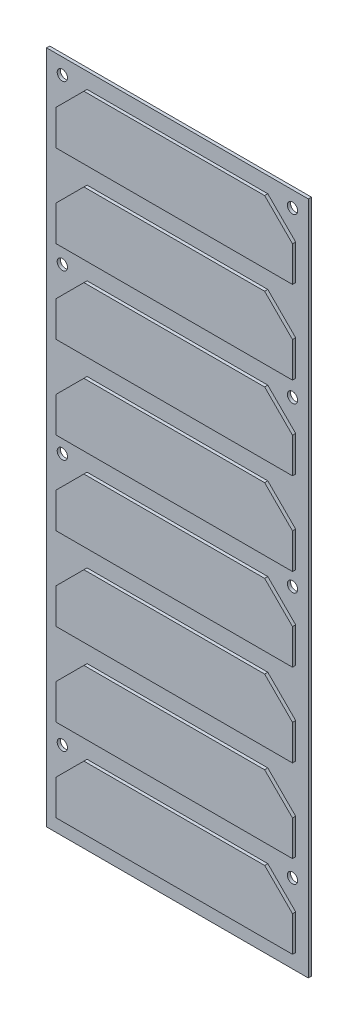
from build123d import *

# Parameters (mm, degrees)
SKETCH1_W                 = 83
SKETCH1_H                 = 214
BOSS_EXTRUDE1_DEPTH       = 1
BOSS_EXTRUDE2_DEPTH       = 1
F_4_CLEARANCE_HOLE1_D     = 3.2639
F_4_CLEARANCE_HOLE1_DEPTH = 3.175
F_4_CLEARANCE_HOLE1_TIP   = 0.980574487


with BuildPart() as part:
    # Sketch1 → Boss-Extrude1 (new body)
    with BuildSketch(Plane.XY):
        Rectangle(SKETCH1_W, SKETCH1_H)
    extrude(amount=BOSS_EXTRUDE1_DEPTH)

    # Sketch2 → Boss-Extrude2 (add)
    with BuildSketch(Plane.XY.offset(1)):
        Polygon((-28.661165235, 102), (28.661165235, 102), (37.5, 93.161165235), (37.5, 82), (-37.5, 82), (-37.5, 93.161165235), align=None)
        Polygon((-28.661165235, 75.714285714), (28.661165235, 75.714285714), (37.5, 66.875450949), (37.5, 55.714285714), (-37.5, 55.714285714), (-37.5, 66.875450949), align=None)
        Polygon((-28.661165235, 49.428571429), (28.661165235, 49.428571429), (37.5, 40.589736664), (37.5, 29.428571429), (-37.5, 29.428571429), (-37.5, 40.589736664), align=None)
        Polygon((-28.661165235, 23.142857143), (28.661165235, 23.142857143), (37.5, 14.304022378), (37.5, 3.142857143), (-37.5, 3.142857143), (-37.5, 14.304022378), align=None)
        Polygon((-28.661165235, -3.142857143), (28.661165235, -3.142857143), (37.5, -11.981691908), (37.5, -23.142857143), (-37.5, -23.142857143), (-37.5, -11.981691908), align=None)
        Polygon((-28.661165235, -29.428571429), (28.661165235, -29.428571429), (37.5, -38.267406193), (37.5, -49.428571429), (-37.5, -49.428571429), (-37.5, -38.267406193), align=None)
        Polygon((-28.661165235, -55.714285714), (28.661165235, -55.714285714), (37.5, -64.553120479), (37.5, -75.714285714), (-37.5, -75.714285714), (-37.5, -64.553120479), align=None)
        Polygon((-28.661165235, -82), (28.661165235, -82), (37.5, -90.838834765), (37.5, -102), (-37.5, -102), (-37.5, -90.838834765), align=None)
    extrude(amount=BOSS_EXTRUDE2_DEPTH)

    # #4 Clearance Hole1
    with Locations(Plane.XY.offset(1)):
        with Locations((-36.5, 102), (36.5, 102), (36.5, 50), (36.5, -2), (36.5, -82), (-36.5, -82), (-36.5, -2), (-36.5, 50)):
            Hole(F_4_CLEARANCE_HOLE1_D / 2, depth=F_4_CLEARANCE_HOLE1_DEPTH)
            with Locations((0, 0, -(F_4_CLEARANCE_HOLE1_DEPTH + F_4_CLEARANCE_HOLE1_TIP / 2))):  # 118° drill point
                Cone(0, F_4_CLEARANCE_HOLE1_D / 2, F_4_CLEARANCE_HOLE1_TIP, mode=Mode.SUBTRACT)


solid = part.part
